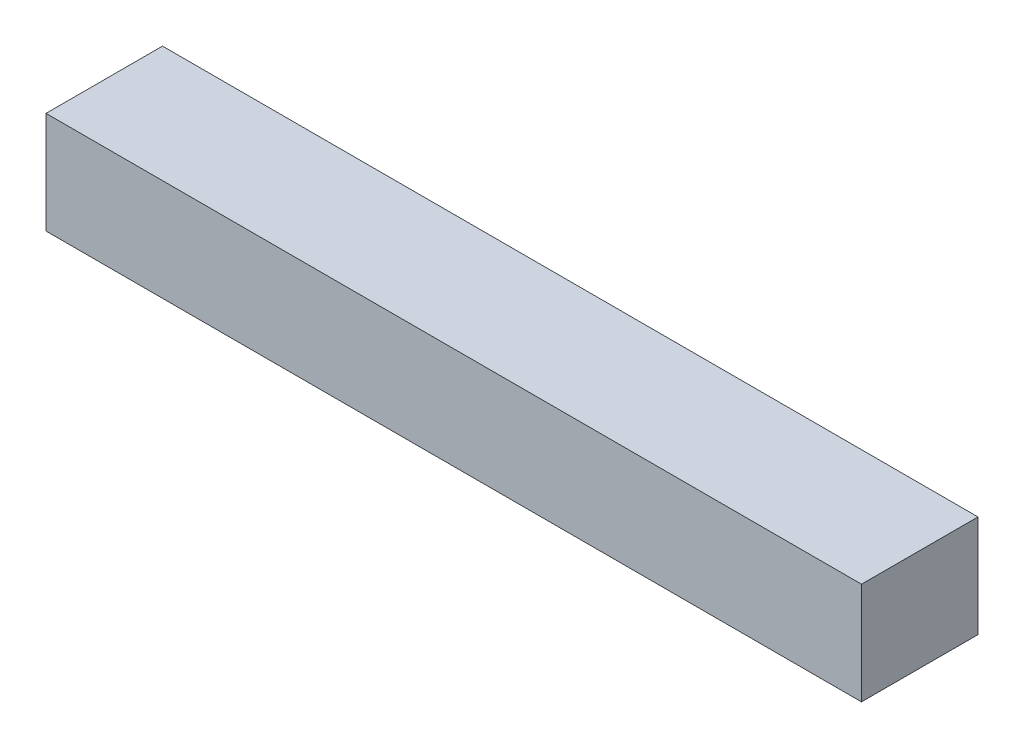
from build123d import *

# Parameters (mm, degrees)
SKETCH1_W           = 8
SKETCH1_H           = 7
BOSS_EXTRUDE1_DEPTH = 56


with BuildPart() as part:
    # Sketch1 → Boss-Extrude1 (new body)
    with BuildSketch(Plane(origin=(0, 0, 0), x_dir=(0, 0, -1), z_dir=(1, 0, 0))):
        with Locations((-11.670398622, -7.549640054)):
            Rectangle(SKETCH1_W, SKETCH1_H)
    extrude(amount=BOSS_EXTRUDE1_DEPTH)


solid = part.part
